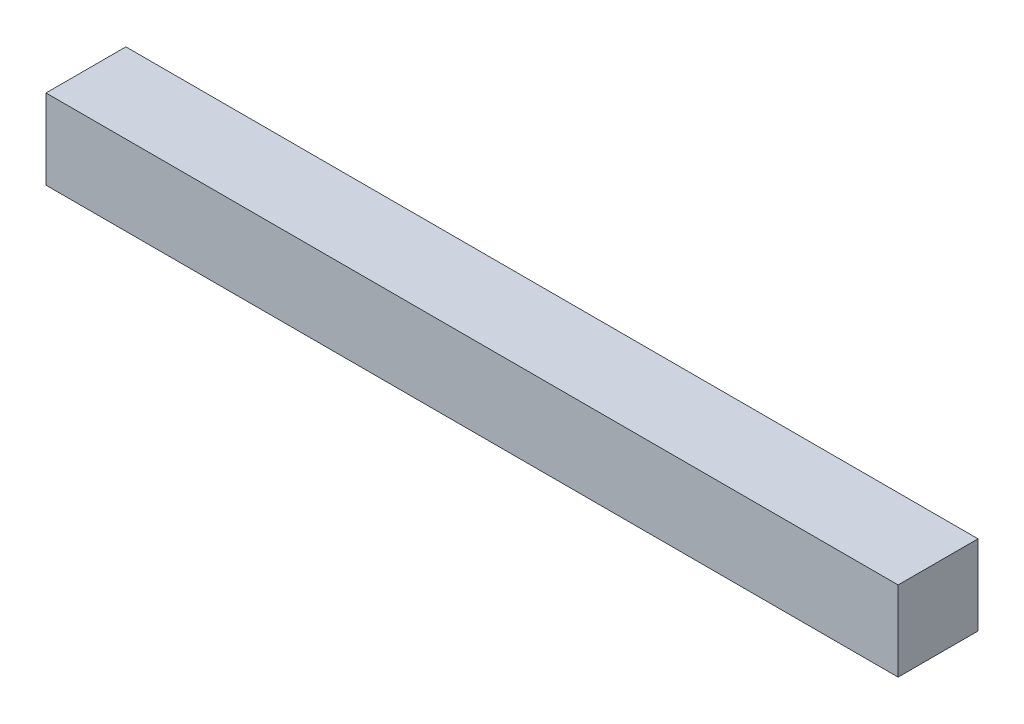
from build123d import *

# Parameters (mm, degrees)
SKETCH1_W           = 38.1
SKETCH1_H           = 38.1
BOSS_EXTRUDE1_DEPTH = 406.4


with BuildPart() as part:
    # Sketch1 → Boss-Extrude1 (new body)
    with BuildSketch(Plane(origin=(0, 0, 0), x_dir=(0, 0, -1), z_dir=(1, 0, 0))):
        with Locations((19.05, -19.05)):
            Rectangle(SKETCH1_W, SKETCH1_H)
    extrude(amount=BOSS_EXTRUDE1_DEPTH)


solid = part.part
